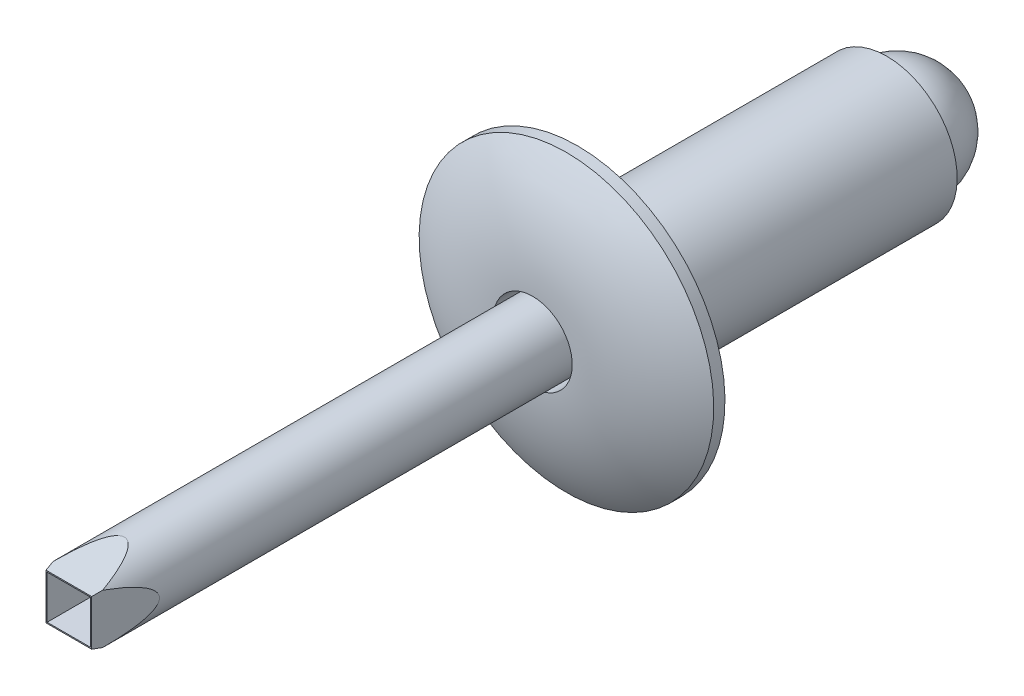
from build123d import *

# Parameters (mm, degrees)
SKETCH7_W          = 12.192
SKETCH7_H          = 0.79375
CUT_EXTRUDE1_DEPTH = 13.419489728
CIRPATTERN1_COUNT  = 2
CIRPATTERN1_ANGLE  = 90
SKETCH9_W          = 0.981075
SKETCH9_H          = 0.981075
CUT_EXTRUDE3_DEPTH = 2.54
FILLET2_R          = 0.254


with BuildPart() as part:
    # Sketch2 → Revolve1 (revolve)
    with BuildSketch(Plane(origin=(0, 0, 0), x_dir=(0, 0, -1), z_dir=(1, 0, 0))):
        with BuildLine():
            Line((6.985, 1.5875), (0, 1.5875))
            Line((0, 1.5875), (0, 3.3274))
            Line((0, 3.3274), (-0.254, 3.3274))
            ThreePointArc((-0.254, 3.3274), (-0.82104942, 2.168419603), (-1.016, 0.89296875))
            Line((-1.016, 0.89296875), (0, 0.89296875))
            Line((0, 0.89296875), (0.6985, 0.89296875))
            Line((0.6985, 0.89296875), (0.6985, 0))
            Line((0.6985, 0), (6.985, 0))
            Line((6.985, 0), (6.985, 1.5875))
        make_face()
    revolve(axis=Axis((0, 0, -6.985), (0, 0, 1)))

    # Fillet2
    fillet2_edges = [part.edges().sort_by_distance(p)[0] for p in [
        (0, -1.5875, 0),
    ]]
    fillet(fillet2_edges, radius=FILLET2_R)


with BuildPart() as body_2:
    # Sketch7 → Revolve2 (revolve)
    with BuildSketch(Plane(origin=(0, 0, 0), x_dir=(0, 0, -1), z_dir=(1, 0, 0)), mode=Mode.PRIVATE) as revolve2_sk:
        with Locations((-5.3975, 0.396875)):
            Rectangle(SKETCH7_W, SKETCH7_H)
    revolve(revolve2_sk.sketch.rotate(Axis((0, 0, 11.4935), (0, 0, -1)), 90), axis=Axis((0, 0, 11.4935), (0, 0, -1)))

    # Sketch3 → Cut-Extrude1 (cut, symmetric)
    with BuildSketch(Plane(origin=(0, 0, 0), x_dir=(1, 0, 0), z_dir=(0, 1, 0))):
        Polygon((-0.99695, -9.323792826), (-0.5159375, -11.4935), (0.5159375, -11.4935), (0.99695, -9.323792826), (0.99695, -12.0015), (-0.99695, -12.0015), align=None)
    cut_extrude1 = extrude(amount=CUT_EXTRUDE1_DEPTH, both=True, mode=Mode.SUBTRACT)

    # CirPattern1: Cut-Extrude1 ×2 about axis
    cirpattern1_axis = Axis((0, 0, 11.4935), (0, 0, -1))
    for i in range(1, CIRPATTERN1_COUNT):
        add(cut_extrude1.rotate(cirpattern1_axis, i * CIRPATTERN1_ANGLE / (CIRPATTERN1_COUNT - 1)), mode=Mode.SUBTRACT)

    # Sketch9 → Cut-Extrude3 (cut)
    with BuildSketch(Plane.XY.offset(11.4935)):
        Rectangle(SKETCH9_W, SKETCH9_H)
    extrude(amount=-CUT_EXTRUDE3_DEPTH, mode=Mode.SUBTRACT)


with BuildPart() as body_3:
    # Sketch8 → Revolve3 (revolve)
    with BuildSketch(Plane(origin=(0, 0, 0), x_dir=(0, 0, -1), z_dir=(1, 0, 0))):
        with BuildLine():
            Line((6.985, 1.27), (6.985, 0))
            Line((6.985, 0), (8.509, 0))
            ThreePointArc((8.509, 0), (8.044418091, 0.991901709), (6.985, 1.27))
        make_face()
    revolve(axis=Axis((0, 0, -6.985), (0, 0, -1)))


solid = Compound([part.part, body_2.part, body_3.part])
